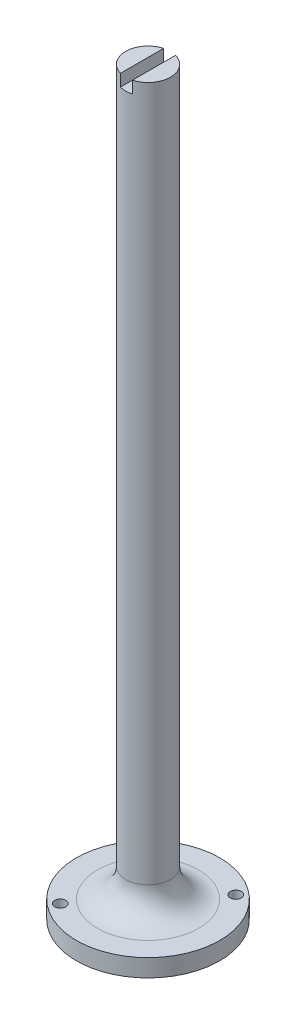
from build123d import *

# Parameters (mm, degrees)
FILLET1_R                       = 4
CUT_EXTRUDE3_DEPTH              = 106.978541224
CUT_EXTRUDE3_DEPTH_BACK         = 106.978541224
SKETCH4_W                       = 1.7
SKETCH4_H                       = 1.7
F_1_16_0_0625_DOWEL_HOLE1_D     = 1.5875
F_1_16_0_0625_DOWEL_HOLE1_DEPTH = 6
F_1_16_0_0625_DOWEL_HOLE1_TIP   = 0.476933116


with BuildPart() as part:
    # Sketch1 → Revolve1 (revolve)
    with BuildSketch(Plane.XY, mode=Mode.PRIVATE) as revolve1_sk:
        Polygon((0, 0), (10.16, 0), (10.16, 2.5), (3.175, 2.5), (3.175, 105), (0, 105), align=None)
    revolve(revolve1_sk.sketch.rotate(Axis((0, -31.831703756, 0), (0, 1, 0)), 90), axis=Axis((0, -31.831703756, 0), (0, 1, 0)))

    # Fillet1
    fillet1_edges = [part.edges().sort_by_distance(p)[0] for p in [
        (0, 2.5, 3.175),
    ]]
    fillet(fillet1_edges, radius=FILLET1_R)

    # Sketch4 → Cut-Extrude3 (cut, two sides: drawn at the far end of the back side and taken through both)
    with BuildSketch(Plane.XY.offset(-CUT_EXTRUDE3_DEPTH_BACK)):
        with Locations((0, 104.15)):
            Rectangle(SKETCH4_W, SKETCH4_H)
    extrude(amount=CUT_EXTRUDE3_DEPTH + CUT_EXTRUDE3_DEPTH_BACK, mode=Mode.SUBTRACT)

    # 1/16 (0.0625) Dowel Hole1
    with Locations(Plane(origin=(0, 0, 0), x_dir=(-1, 0, 0), z_dir=(0, -1, 0))):
        with Locations((5.675039265, -6.764822935), (-5.675039265, 6.764822935)):
            Hole(F_1_16_0_0625_DOWEL_HOLE1_D / 2, depth=F_1_16_0_0625_DOWEL_HOLE1_DEPTH)
            with Locations((0, 0, -(F_1_16_0_0625_DOWEL_HOLE1_DEPTH + F_1_16_0_0625_DOWEL_HOLE1_TIP / 2))):  # 118° drill point
                Cone(0, F_1_16_0_0625_DOWEL_HOLE1_D / 2, F_1_16_0_0625_DOWEL_HOLE1_TIP, mode=Mode.SUBTRACT)


solid = part.part
